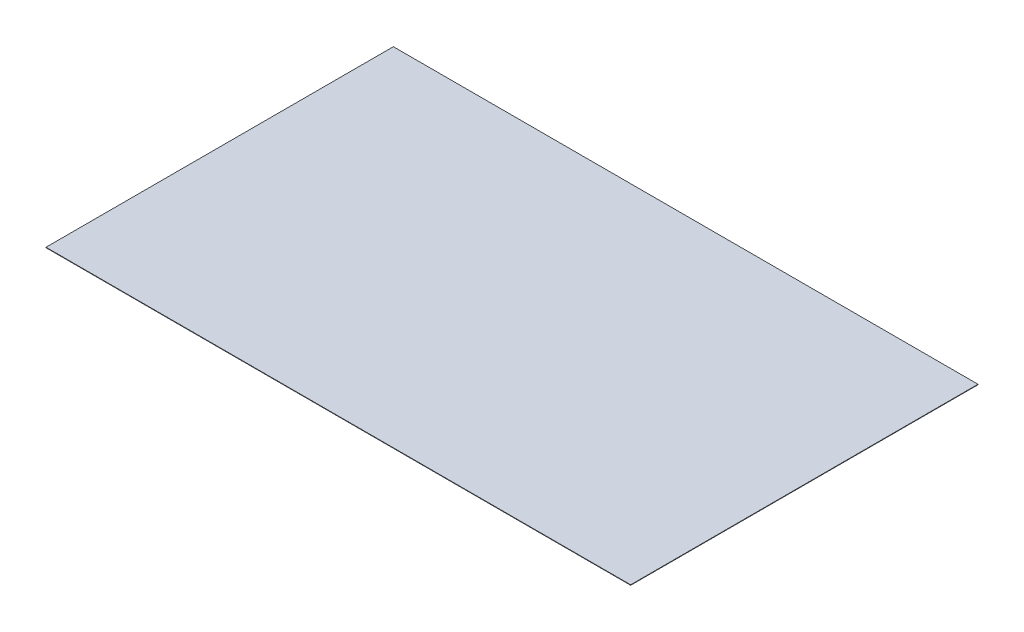
from build123d import *

# Parameters (mm, degrees)
SKETCH1_W              = 1275
SKETCH1_H              = 1
STORE_IC_TAVAN_1_DEPTH = 757.5


with BuildPart() as part:
    # Sketch1 → STORE_ic_tavan_1 (new body)
    with BuildSketch(Plane.XY):
        with Locations((700, 1610.5)):
            Rectangle(SKETCH1_W, SKETCH1_H)
    extrude(amount=-STORE_IC_TAVAN_1_DEPTH)


solid = part.part
